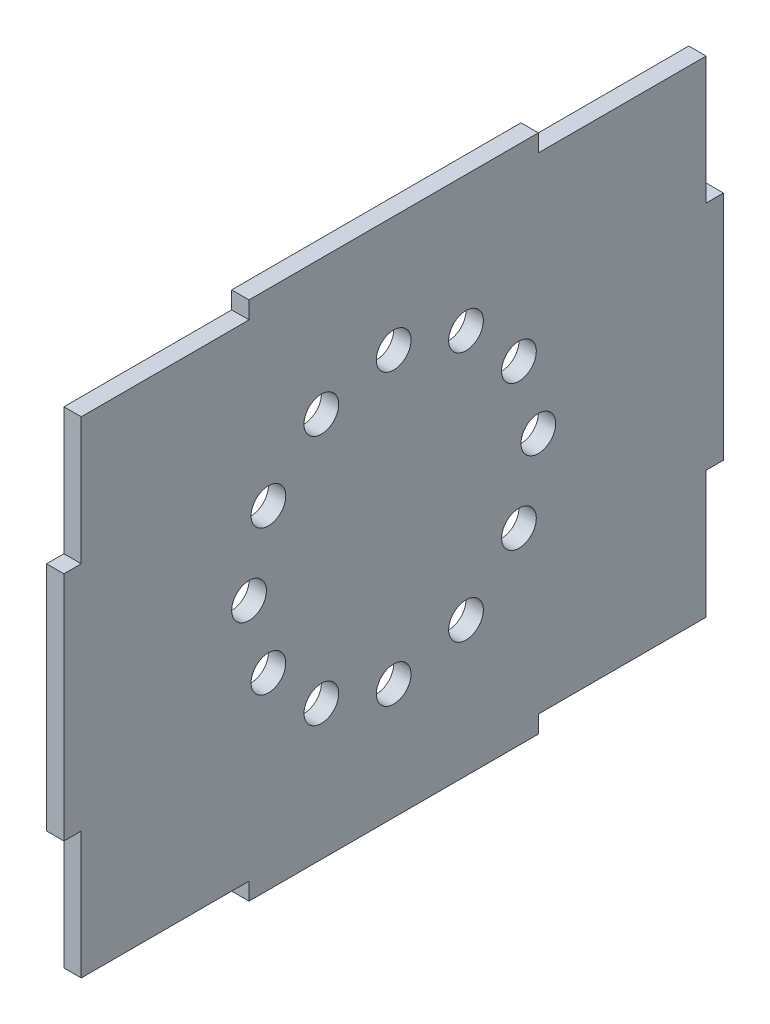
from build123d import *

# Parameters (mm, degrees)
EXTRUDE_1_DEPTH     = 3
SKETCH_2_R          = 3
CUT_EXTRUDE_1_DEPTH = 146.275600154


with BuildPart() as part:
    # Эскиз1 → Бобышка-Вытянуть1 (new body)
    with BuildSketch(Plane(origin=(0, 0, 0), x_dir=(0, 0, -1), z_dir=(1, 0, 0))):
        Polygon((0, 65), (0, 25), (3, 25), (3, 3), (32, 3), (32, 0), (82, 0), (82, 3), (111, 3), (111, 25), (114, 25), (114, 65), (111, 65), (111, 87), (82, 87), (82, 90), (32, 90), (32, 87), (3, 87), (3, 65), align=None)
    extrude(amount=EXTRUDE_1_DEPTH)

    # Эскиз2 → Вырез-Вытянуть1 (cut, through all)
    with BuildSketch(Plane(origin=(3, 0, 0), x_dir=(0, 0, -1), z_dir=(1, 0, 0))):
        with Locations((32, 45)):
            Circle(SKETCH_2_R)
        with Locations((35.349364905, 57.5)):
            Circle(SKETCH_2_R)
        with Locations((44.5, 66.650635095)):
            Circle(SKETCH_2_R)
        with Locations((57, 70)):
            Circle(SKETCH_2_R)
        with Locations((69.5, 66.650635095)):
            Circle(SKETCH_2_R)
        with Locations((78.650635095, 57.5)):
            Circle(SKETCH_2_R)
        with Locations((82, 45)):
            Circle(SKETCH_2_R)
        with Locations((78.650635095, 32.5)):
            Circle(SKETCH_2_R)
        with Locations((69.5, 23.349364905)):
            Circle(SKETCH_2_R)
        with Locations((57, 20)):
            Circle(SKETCH_2_R)
        with Locations((44.5, 23.349364905)):
            Circle(SKETCH_2_R)
        with Locations((35.349364905, 32.5)):
            Circle(SKETCH_2_R)
    extrude(amount=-CUT_EXTRUDE_1_DEPTH, mode=Mode.SUBTRACT)


solid = part.part
